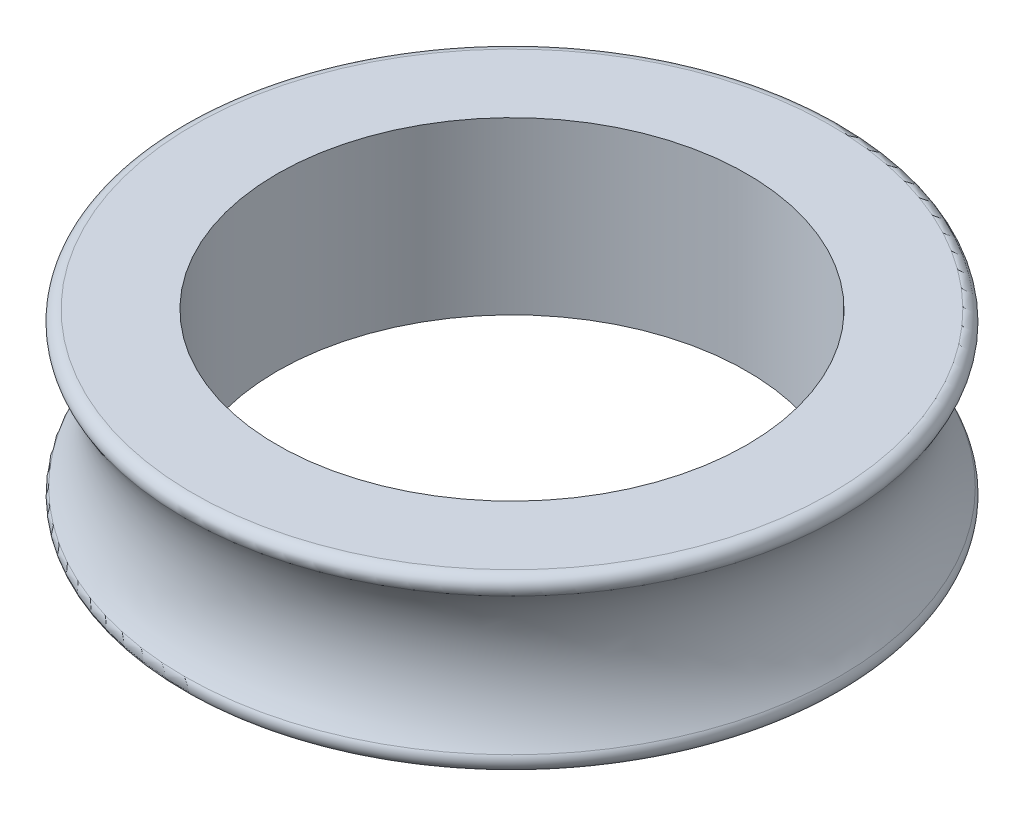
from build123d import *

# Parameters (mm, degrees)
FILLET1_R = 0.5


with BuildPart() as part:
    # Sketch1 → Revolve1 (revolve)
    with BuildSketch(Plane.XY, mode=Mode.PRIVATE) as revolve1_sk:
        with BuildLine():
            Line((-16, 4), (-11, 4))
            Line((-11, 4), (-11, -4))
            Line((-11, -4), (-16, -4))
            ThreePointArc((-16, -4), (-14.343145751, 0), (-16, 4))
        make_face()
    revolve(revolve1_sk.sketch.rotate(Axis((0, -1000, 0), (0, 1, 0)), 180), axis=Axis((0, -1000, 0), (0, 1, 0)))

    # Fillet1
    fillet1_edges = [part.edges().sort_by_distance(p)[0] for p in [
        (-16, -4, 0),
        (-16, 4, 0),
    ]]
    fillet(fillet1_edges, radius=FILLET1_R)


solid = part.part
